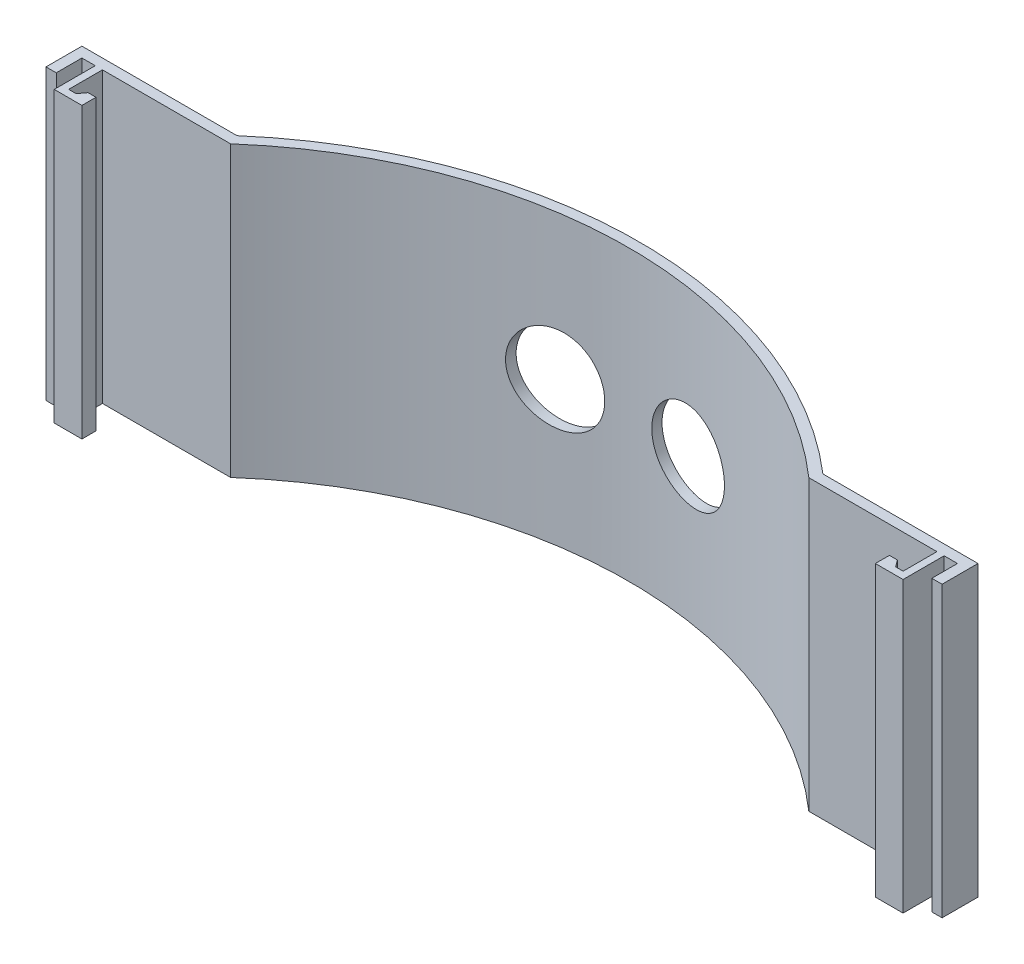
from build123d import *

# Parameters (mm, degrees)
BOSS_EXTRUDE1_DEPTH = 56.3
SKETCH2_R           = 8.37
CUT_EXTRUDE1_DEPTH  = 109.485473941


with BuildPart() as part:
    # Sketch1 → Boss-Extrude1 (new body)
    with BuildSketch(Plane(origin=(0, 0, 0), x_dir=(1, 0, 0), z_dir=(0, 1, 0))):
        with BuildLine():
            Line((-85.3, 58.95), (-87.3, 58.95))
            Line((-87.3, 58.95), (-87.3, 65.95))
            Line((-87.3, 65.95), (-82, 65.95))
            Line((-82, 65.95), (-57.085698874, 65.95))
            ThreePointArc((-57.085698874, 65.95), (-30.460620038, 81.733286627), (0, 87.224878997))
            ThreePointArc((0, 87.224878997), (30.460620038, 81.733286627), (57.085698874, 65.95))
            Line((57.085698874, 65.95), (82, 65.95))
            Line((82, 65.95), (87.3, 65.95))
            Line((87.3, 65.95), (87.3, 58.95))
            Line((87.3, 58.95), (85.3, 58.95))
            Line((85.3, 58.95), (85.3, 63.95))
            Line((85.3, 63.95), (82.7, 63.95))
            Line((82.7, 63.95), (82.7, 55.95))
            Line((82.7, 55.95), (77.3, 55.95))
            Line((77.3, 55.95), (77.3, 58.692745098))
            Line((77.3, 58.692745098), (78.85, 58.692745098))
            Line((78.85, 58.692745098), (79.85, 57.359411765))
            Line((79.85, 57.359411765), (81.3, 57.359411765))
            Line((81.3, 57.359411765), (81.3, 63.95))
            Line((81.3, 63.95), (56.335401836, 63.95))
            ThreePointArc((56.335401836, 63.95), (30.109375518, 79.728950237), (0, 85.224878997))
            ThreePointArc((0, 85.224878997), (-30.109375518, 79.728950237), (-56.335401836, 63.95))
            Line((-56.335401836, 63.95), (-81.3, 63.95))
            Line((-81.3, 63.95), (-81.3, 57.359411765))
            Line((-81.3, 57.359411765), (-79.85, 57.359411765))
            Line((-79.85, 57.359411765), (-78.85, 58.692745098))
            Line((-78.85, 58.692745098), (-77.3, 58.692745098))
            Line((-77.3, 58.692745098), (-77.3, 55.95))
            Line((-77.3, 55.95), (-82.7, 55.95))
            Line((-82.7, 55.95), (-82.7, 63.95))
            Line((-82.7, 63.95), (-85.3, 63.95))
            Line((-85.3, 63.95), (-85.3, 58.95))
        make_face()
    extrude(amount=BOSS_EXTRUDE1_DEPTH)

    # Sketch2 → Cut-Extrude1 (cut, through all)
    with BuildSketch(Plane.XY.offset(-55.95)):
        with Locations((12.955, 28.15)):
            Circle(SKETCH2_R)
        with Locations((-12.955, 28.15)):
            Circle(SKETCH2_R)
    extrude(amount=-CUT_EXTRUDE1_DEPTH, mode=Mode.SUBTRACT)


solid = part.part
